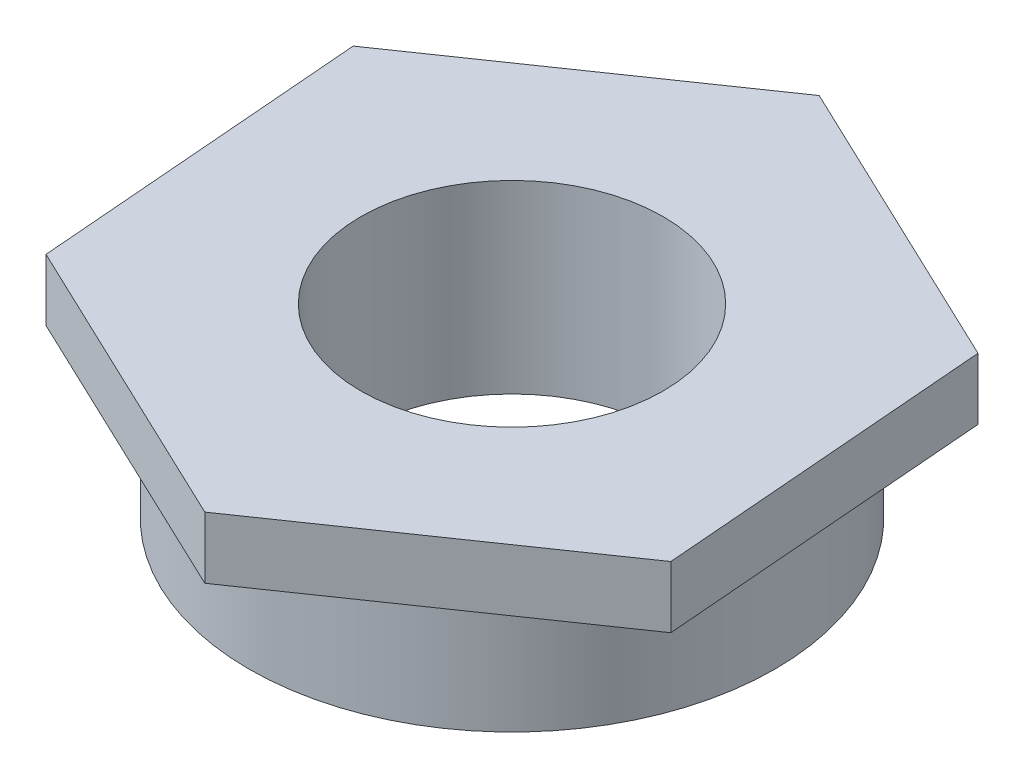
from build123d import *

# Parameters (mm, degrees)
EXTRUDE_1_DEPTH     = 0.51
SKETCH_2_R          = 2.175
EXTRUDE_2_DEPTH     = 1.02
SKETCH_3_R          = 1.25
CUT_EXTRUDE_1_DEPTH = 5.029563181


with BuildPart() as part:
    # 草图1 → 凸台-拉伸1 (new body)
    with BuildSketch(Plane(origin=(0, 0, 0), x_dir=(1, 0, 0), z_dir=(0, 1, 0))):
        Polygon((2.503115377, -1.189291137), (2.281514026, 1.573115937), (-0.221601352, 2.762407074), (-2.503115377, 1.189291137), (-2.281514026, -1.573115937), (0.221601352, -2.762407074), align=None)
    extrude(amount=EXTRUDE_1_DEPTH)

    # 草图2 → 凸台-拉伸2 (add)
    with BuildSketch(Plane.XZ):
        with Locations(Location((0, 0, 0), (0, 0, 270))):
            Circle(SKETCH_2_R)
    extrude(amount=EXTRUDE_2_DEPTH)

    # 草图3 → 切除-拉伸1 (cut, through all)
    with BuildSketch(Plane(origin=(0, -1.02, 0), x_dir=(-1, 0, 0), z_dir=(0, -1, 0))):
        with Locations(Location((0, 0, 0), (0, 0, 90))):
            Circle(SKETCH_3_R)
    extrude(amount=-CUT_EXTRUDE_1_DEPTH, mode=Mode.SUBTRACT)


solid = part.part
